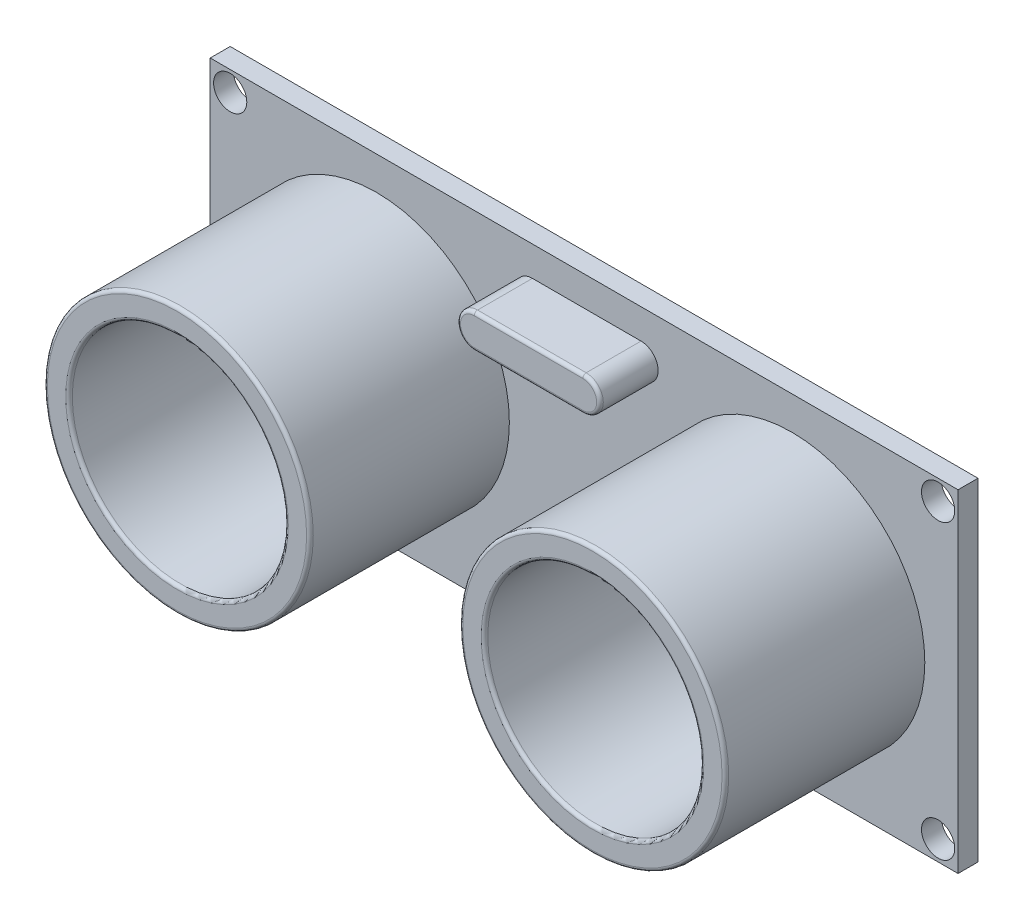
from build123d import *

# Parameters (mm, degrees)
SKETCH_1_W             = 45
SKETCH_1_H             = 20
SKETCH_1_R             = 1
EXTRUDE_1_DEPTH        = 1.2
SKETCH_2_R             = 8
SKETCH_2_R_2           = 6.5
EXTRUDE_2_DEPTH        = 12
EXTRUDE_3_DEPTH        = 3.5
FILLET_1_R             = 0.2
SKETCH_5_W             = 10.5
SKETCH_5_H             = 2.5
EXTRUDE_4_DEPTH        = 2.5
FILLET_2_R             = 0.8
SKETCH_7_R             = 0.4
PATTERN_LINEAR_1_COUNT = 4
PATTERN_LINEAR_1_PITCH = 2


with BuildPart() as part:
    # 草图1 → 凸台-拉伸1 (new body)
    with BuildSketch(Plane.XY):
        with Locations((-7.47337963, 3.653935185)):
            Rectangle(SKETCH_1_W, SKETCH_1_H)
        with Locations((-28.77337963, 12.453935185)):
            Circle(SKETCH_1_R, mode=Mode.SUBTRACT)
        with Locations((-28.77337963, -5.146064815)):
            Circle(SKETCH_1_R, mode=Mode.SUBTRACT)
        with Locations((13.82662037, 12.453935185)):
            Circle(SKETCH_1_R, mode=Mode.SUBTRACT)
        with Locations((13.82662037, -5.146064815)):
            Circle(SKETCH_1_R, mode=Mode.SUBTRACT)
    extrude(amount=EXTRUDE_1_DEPTH)

    # 草图2 → 凸台-拉伸2 (add)
    # profile 1 of 2: a face of its own
    with BuildSketch(Plane.XY.offset(1.2)):
        with Locations((-19.97337963, 3.653935185)):
            Circle(SKETCH_2_R)
        with Locations((-19.97337963, 3.653935185)):
            Circle(SKETCH_2_R_2, mode=Mode.SUBTRACT)
    # profile 2 of 2: a face of its own
    with BuildSketch(Plane.XY.offset(1.2)):
        with Locations((5.02662037, 3.653935185)):
            Circle(SKETCH_2_R)
        with Locations((5.02662037, 3.653935185)):
            Circle(SKETCH_2_R_2, mode=Mode.SUBTRACT)
    extrude(amount=EXTRUDE_2_DEPTH)

    # 草图3 → 凸台-拉伸3 (add)
    with BuildSketch(Plane.XY.offset(1.2)):
        with BuildLine():
            Line((-10.586927782, 11.862380315), (-4.051049842, 11.862380315))
            ThreePointArc((-4.051049842, 11.862380315), (-3.021777725, 10.833108198), (-4.051049842, 9.803836082))
            Line((-4.051049842, 9.803836082), (-10.586927782, 9.803836082))
            ThreePointArc((-10.586927782, 9.803836082), (-11.616199899, 10.833108198), (-10.586927782, 11.862380315))
        make_face()
    extrude(amount=EXTRUDE_3_DEPTH)

    # 圆角1
    fillet_1_edges = [part.edges().sort_by_distance(p)[0] for p in [
        (-27.97337963, 3.653935185, 13.2),
        (-26.47337963, 3.653935185, 13.2),
        (-2.97337963, 3.653935185, 13.2),
        (-1.47337963, 3.653935185, 13.2),
        (-11.616199899, 10.833108198, 4.7),
        (-7.318988812, 9.803836082, 4.7),
        (-3.021777725, 10.833108198, 4.7),
        (-7.318988812, 11.862380315, 4.7),
    ]]
    fillet(fillet_1_edges, radius=FILLET_1_R)

    # 草图5 → 凸台-拉伸4 (add)
    with BuildSketch(Plane(origin=(0, 0, 0), x_dir=(-1, 0, 0), z_dir=(0, 0, -1))):
        with Locations((7.22337963, -4.596064815)):
            Rectangle(SKETCH_5_W, SKETCH_5_H)
    extrude(amount=EXTRUDE_4_DEPTH)

    # 圆角2
    fillet_2_edges = [part.edges().sort_by_distance(p)[0] for p in [
        (-1.97337963, -3.346064815, -1.25),
        (-1.97337963, -5.846064815, -1.25),
        (-12.47337963, -5.846064815, -1.25),
        (-12.47337963, -3.346064815, -1.25),
    ]]
    fillet(fillet_2_edges, radius=FILLET_2_R)

    # 扫描1: sweep along a path in 草图8
    with BuildLine(Plane(origin=(-4.17337963, 0, 0), x_dir=(0, 0, -1), z_dir=(1, 0, 0))) as sweep_1_path:
        Line((2.5, -4.774131983), (4, -4.774131983))
        ThreePointArc((4, -4.774131983), (4.527384697, -4.992581877), (4.74583459, -5.519966573))
        Line((4.74583459, -5.519966573), (4.74583459, -12.519966573))
    # 草图7 → 扫描1 (sweep)
    with BuildSketch(Plane(origin=(0, 0, -2.5), x_dir=(-1, 0, 0), z_dir=(0, 0, -1))):
        with Locations((4.17337963, -4.774131983)):
            Circle(SKETCH_7_R)
    sweep_1 = sweep(path=sweep_1_path.line)

    # 阵列(线性)1: 扫描1 ×4
    with Locations(*[(-i * PATTERN_LINEAR_1_PITCH, 0, 0) for i in range(1, PATTERN_LINEAR_1_COUNT)]):
        add(sweep_1)


solid = part.part
